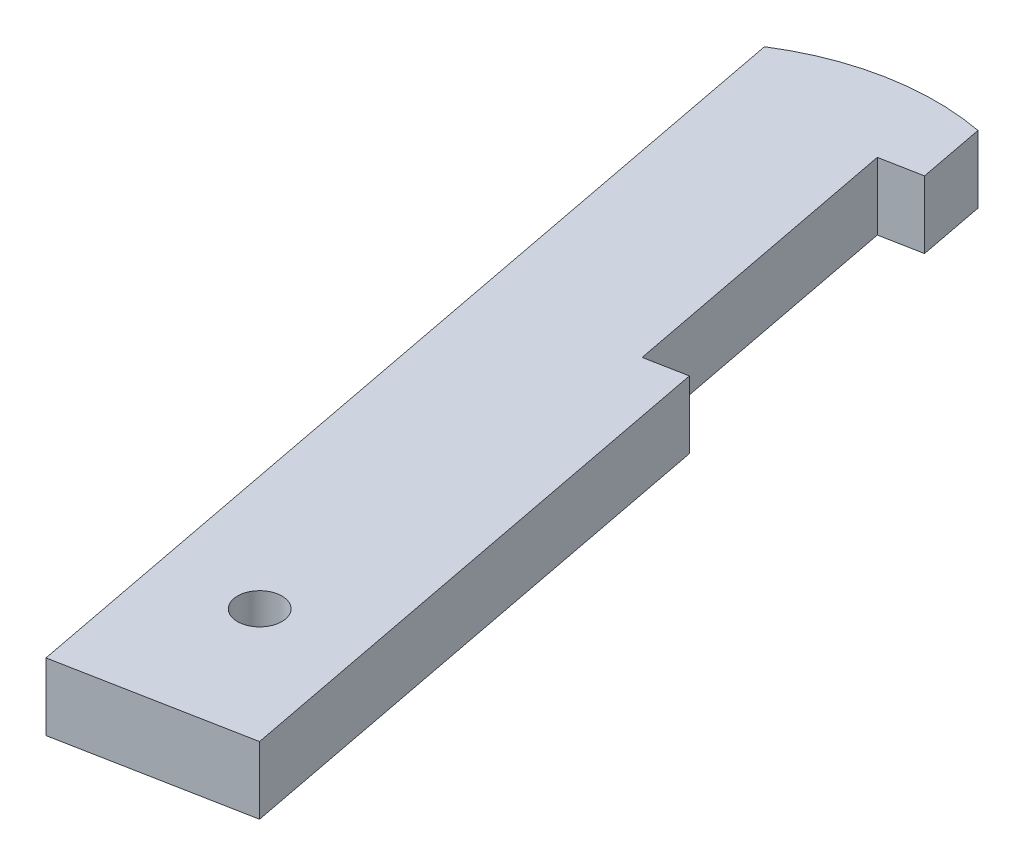
from build123d import *

# Parameters (mm, degrees)
SKETCH1_R           = 1.65
BOSS_EXTRUDE1_DEPTH = 5


with BuildPart() as part:
    # Sketch1 → Boss-Extrude1 (new body)
    with BuildSketch(Plane(origin=(0, 0, 0), x_dir=(1, 0, 0), z_dir=(0, 1, 0))):
        with BuildLine():
            Line((-9.894821287, 15.631459039), (2.73993599, -50.383143518))
            Line((2.73993599, -50.383143518), (16.058196483, -47.834116755))
            Line((16.058196483, -47.834116755), (8.498934973, -8.338174471))
            Line((8.498934973, -8.338174471), (5.552417165, -8.902118446))
            Line((5.552417165, -8.902118446), (1.416828021, 12.705678814))
            Line((1.416828021, 12.705678814), (4.363345829, 13.269622789))
            Line((4.363345829, 13.269622789), (3.423439206, 18.180485802))
            ThreePointArc((3.423439206, 18.180485802), (-3.477654507, 18.170193151), (-9.894821287, 15.631459039))
        make_face()
        with Locations(Location((7.519252989, -39.286904109, 0), (0, 0, 270))):
            Circle(SKETCH1_R, mode=Mode.SUBTRACT)
    extrude(amount=BOSS_EXTRUDE1_DEPTH)


solid = part.part
